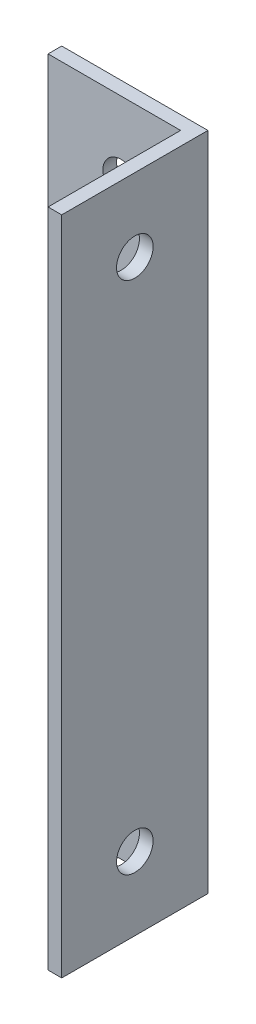
from build123d import *

# Parameters (mm, degrees)
BOSS_EXTRUDE1_DEPTH = 86.106
SKETCH2_R           = 2.38125
CUT_EXTRUDE1_DEPTH  = 1.778
SKETCH3_R           = 2.38125
CUT_EXTRUDE2_DEPTH  = 1.778


with BuildPart() as part:
    # Sketch1 → Boss-Extrude1 (new body)
    with BuildSketch(Plane(origin=(0, 0, 0), x_dir=(1, 0, 0), z_dir=(0, 1, 0))):
        Polygon((0, 0), (0, 19.05), (-19.05, 19.05), (-19.05, 17.272), (-1.778, 17.272), (-1.778, 0), align=None)
    extrude(amount=BOSS_EXTRUDE1_DEPTH)

    # Sketch2 → Cut-Extrude1 (cut)
    with BuildSketch(Plane.ZY.offset(1.778)):
        with Locations((-9.525, 76.581)):
            Circle(SKETCH2_R)
        with Locations((-9.525, 9.525)):
            Circle(SKETCH2_R)
    extrude(amount=-CUT_EXTRUDE1_DEPTH, mode=Mode.SUBTRACT)

    # Sketch3 → Cut-Extrude2 (cut)
    with BuildSketch(Plane.XY.offset(-17.272)):
        with Locations((-9.525, 9.525)):
            Circle(SKETCH3_R)
        with Locations((-9.525, 76.581)):
            Circle(SKETCH3_R)
    extrude(amount=-CUT_EXTRUDE2_DEPTH, mode=Mode.SUBTRACT)


solid = part.part
